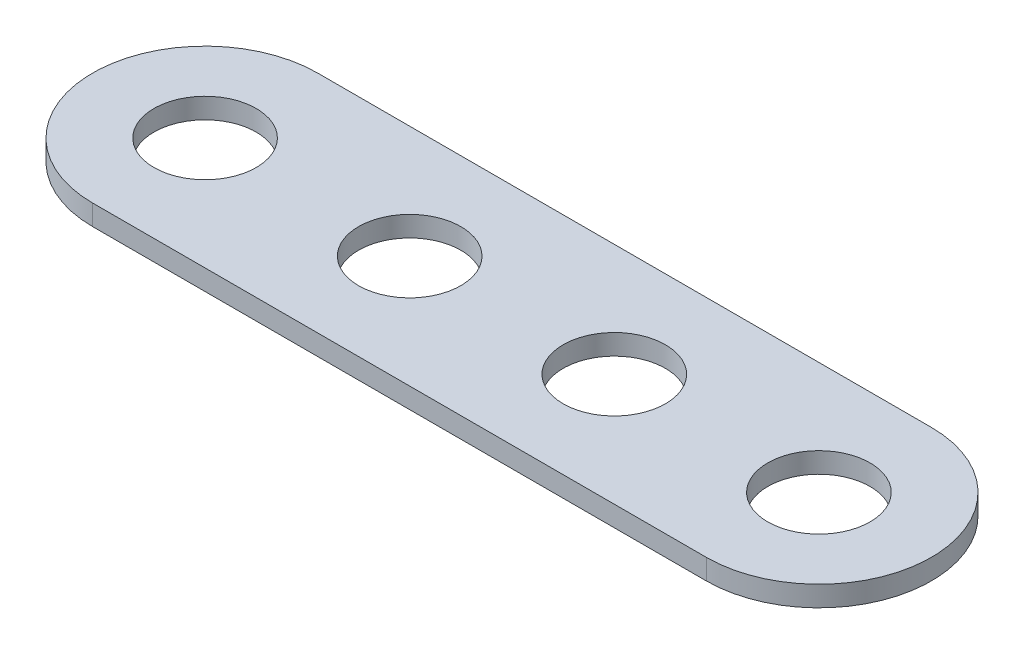
from build123d import *

# Parameters (mm, degrees)
SKIZZE1_R                       = 2.5
AUFSATZ_LINEAR_AUSTRAGEN1_DEPTH = 1


with BuildPart() as part:
    # Skizze1 → Aufsatz-Linear austragen1 (new body)
    with BuildSketch(Plane(origin=(0, 0, 0), x_dir=(1, 0, 0), z_dir=(0, 1, 0))):
        with BuildLine():
            Line((0, -5.5), (-30, -5.5))
            ThreePointArc((-30, -5.5), (-35.5, 0), (-30, 5.5))
            Line((-30, 5.5), (0, 5.5))
            ThreePointArc((0, 5.5), (5.5, 0), (0, -5.5))
        make_face()
        with Locations(Location((0, 0, 0), (0, 0, 270))):
            Circle(SKIZZE1_R, mode=Mode.SUBTRACT)
        with Locations(Location((-20, 0, 0), (0, 0, 270))):
            Circle(SKIZZE1_R, mode=Mode.SUBTRACT)
        with Locations(Location((-10, 0, 0), (0, 0, 270))):
            Circle(SKIZZE1_R, mode=Mode.SUBTRACT)
        with Locations(Location((-30, 0, 0), (0, 0, 270))):
            Circle(SKIZZE1_R, mode=Mode.SUBTRACT)
    extrude(amount=AUFSATZ_LINEAR_AUSTRAGEN1_DEPTH)


solid = part.part
